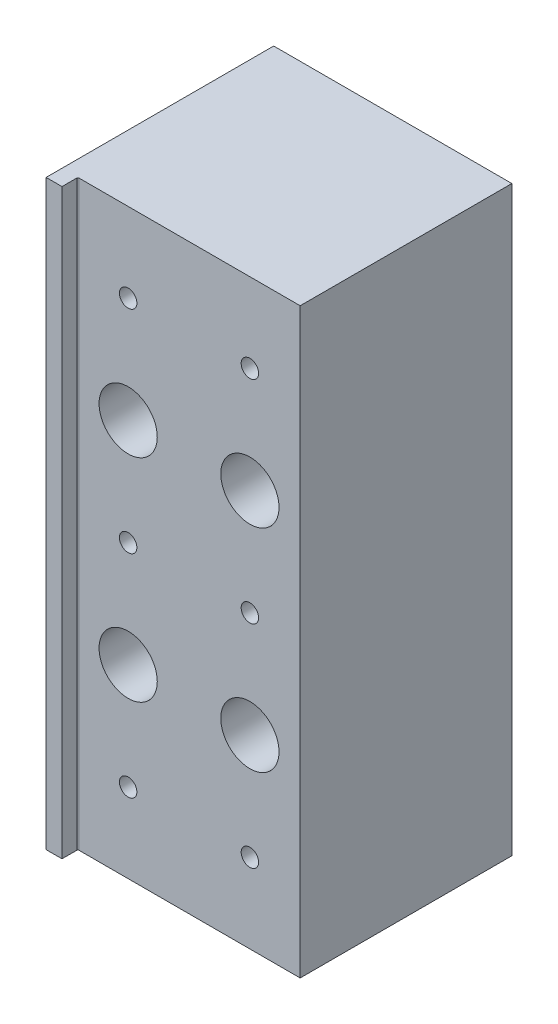
from build123d import *

# Parameters (mm, degrees)
EXTRUDE_1_DEPTH        = 110
FILLET_1_R             = 0.2
SKETCH_2_R             = 5.5
CUT_EXTRUDE_1_DEPTH    = 8
SKETCH_3_R             = 3.5
CUT_EXTRUDE_2_DEPTH    = 124.081273962
HOLE_WIZARD_M4_1_D     = 3.3
HOLE_WIZARD_M4_1_DEPTH = 16.5
HOLE_WIZARD_M4_1_TIP   = 0.991420021


with BuildPart() as part:
    # 스케치1 → 보스-돌출1 (new body)
    with BuildSketch(Plane(origin=(0, 0, 0), x_dir=(1, 0, 0), z_dir=(0, 1, 0))):
        Polygon((0, -43), (0, 0), (45, 0), (45, -40), (3, -40), (3, -43), align=None)
    extrude(amount=EXTRUDE_1_DEPTH)

    # 필렛1
    fillet_1_edges = [part.edges().sort_by_distance(p)[0] for p in [
        (3, 55, 40),
    ]]
    fillet(fillet_1_edges, radius=FILLET_1_R)

    # 스케치2 → 컷-돌출1 (cut)
    with BuildSketch(Plane.XY.offset(40)):
        with Locations((12.5, 75)):
            Circle(SKETCH_2_R)
        with Locations((35.5, 75)):
            Circle(SKETCH_2_R)
        with Locations((12.5, 35)):
            Circle(SKETCH_2_R)
        with Locations((35.5, 35)):
            Circle(SKETCH_2_R)
    extrude(amount=-CUT_EXTRUDE_1_DEPTH, mode=Mode.SUBTRACT)

    # 스케치3 → 컷-돌출2 (cut, through all)
    with BuildSketch(Plane.XY.offset(32)):
        with Locations((12.5, 75)):
            Circle(SKETCH_3_R)
        with Locations((35.5, 75)):
            Circle(SKETCH_3_R)
        with Locations((35.5, 35)):
            Circle(SKETCH_3_R)
        with Locations((12.5, 35)):
            Circle(SKETCH_3_R)
    extrude(amount=-CUT_EXTRUDE_2_DEPTH, mode=Mode.SUBTRACT)

    # M4 나사 구멍1
    with Locations(Plane.XY.offset(40)):
        with Locations((12.5, 95), (12.5, 15), (12.5, 55), (35.5, 55), (35.5, 95), (35.5, 15)):
            Hole(HOLE_WIZARD_M4_1_D / 2, depth=HOLE_WIZARD_M4_1_DEPTH)
            with Locations((0, 0, -(HOLE_WIZARD_M4_1_DEPTH + HOLE_WIZARD_M4_1_TIP / 2))):  # 118° drill point
                Cone(0, HOLE_WIZARD_M4_1_D / 2, HOLE_WIZARD_M4_1_TIP, mode=Mode.SUBTRACT)


solid = part.part
